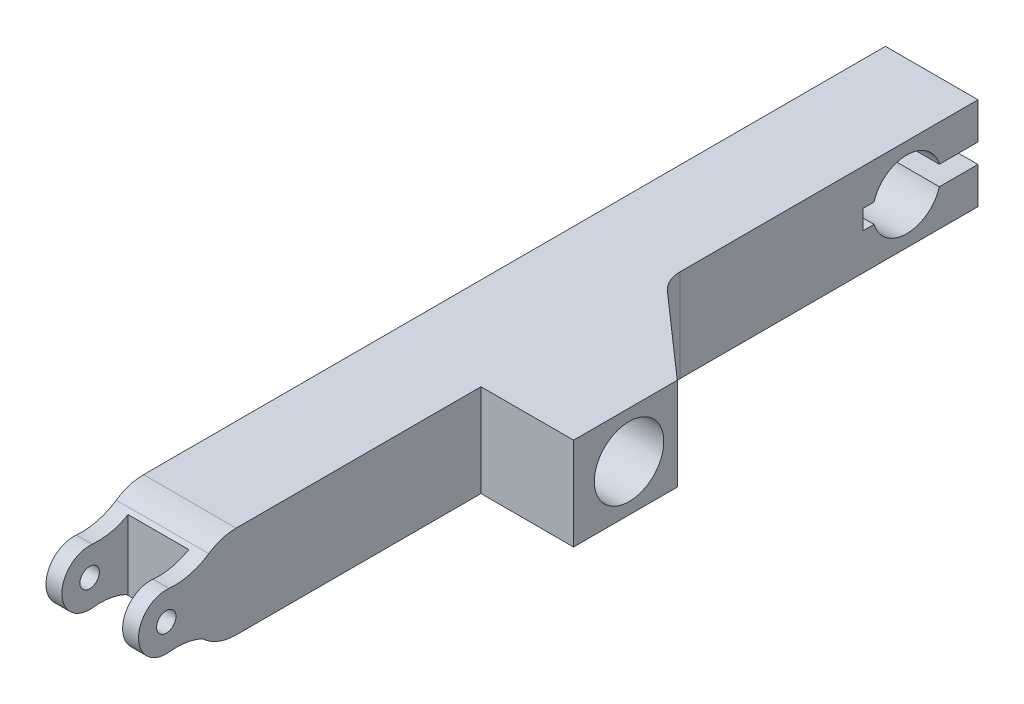
from build123d import *

# Parameters (mm, degrees)
SKETCH1_R           = 14.2875
BOSS_EXTRUDE1_DEPTH = 38.1
SKETCH2_W           = 76.2
SKETCH2_H           = 38.1
SKETCH2_R           = 14.2875
BOSS_EXTRUDE2_DEPTH = 38.1
CUT_EXTRUDE1_DEPTH  = 38.1
FILLET1_R           = 12.7
SKETCH4_W           = 38.1
SKETCH4_H           = 38.1
BOSS_EXTRUDE3_DEPTH = 152.4
SKETCH5_R           = 4
CUT_EXTRUDE2_DEPTH  = 152.4
SKETCH6_W           = 25
SKETCH6_H           = 54.519891076
CUT_EXTRUDE3_DEPTH  = 152.4


with BuildPart() as part:
    # Sketch1 → Boss-Extrude1 (new body)
    with BuildSketch(Plane(origin=(0, 0, 0), x_dir=(0, 0, -1), z_dir=(1, 0, 0))):
        with BuildLine():
            Line((29.337186502, -19.05), (-175.255687154, -19.05))
            Line((-175.255687154, -19.05), (-175.255687154, 19.05))
            Line((-175.255687154, 19.05), (29.337186502, 19.05))
            Line((29.337186502, 19.05), (29.337186502, 4))
            Line((29.337186502, 4), (13.442493258, 4))
            ThreePointArc((13.442493258, 4), (0, 14.025), (-13.442493258, 4))
            Line((-13.442493258, 4), (-18.025, 4))
            Line((-18.025, 4), (-18.025, -4))
            Line((-18.025, -4), (-13.442493258, -4))
            ThreePointArc((-13.442493258, -4), (0, -14.025), (13.442493258, -4))
            Line((13.442493258, -4), (29.337186502, -4))
            Line((29.337186502, -4), (29.337186502, -19.05))
        make_face()
        with Locations(Location((-152.4, 0, 0), (0, 0, 180))):
            Circle(SKETCH1_R, mode=Mode.SUBTRACT)
    extrude(amount=BOSS_EXTRUDE1_DEPTH)

    # Sketch2 → Boss-Extrude2 (add)
    with BuildSketch(Plane(origin=(38.1, 0, 0), x_dir=(0, 0, -1), z_dir=(1, 0, 0))):
        with Locations((-137.155687154, 0)):
            Rectangle(SKETCH2_W, SKETCH2_H)
        with Locations(Location((-152.4, 0, 0), (0, 0, 180))):
            Circle(SKETCH2_R, mode=Mode.SUBTRACT)
    extrude(amount=BOSS_EXTRUDE2_DEPTH)

    # Sketch3 → Cut-Extrude1 (cut)
    with BuildSketch(Plane(origin=(0, 19.05, 0), x_dir=(1, 0, 0), z_dir=(0, 1, 0))):
        Polygon((38.1, -99.055687154), (76.2, -132.562404594), (94.277321555, -84.449227978), align=None)
    extrude(amount=-CUT_EXTRUDE1_DEPTH, mode=Mode.SUBTRACT)

    # Fillet1
    fillet1_edges = [part.edges().sort_by_distance(p)[0] for p in [
        (38.1, 0, 99.055687154),
    ]]
    fillet(fillet1_edges, radius=FILLET1_R)

    # Sketch4 → Boss-Extrude3 (add)
    with BuildSketch(Plane.XY.offset(175.255687154)):
        with Locations((19.05, 0)):
            Rectangle(SKETCH4_W, SKETCH4_H)
    extrude(amount=BOSS_EXTRUDE3_DEPTH)

    # Sketch5 → Cut-Extrude2 (cut)
    with BuildSketch(Plane.ZY):
        Polygon((276.061983206, 26.741787919), (276.061983206, 19.05), (327.655687154, 19.05), (327.655687154, -19.05), (276.061983206, -19.05), (276.061983206, -31.426856949), (335.038222157, -31.426856949), (335.038222157, 26.741787919), align=None)
        with BuildLine():
            Line((327.655687154, 19.05), (276.061983206, 19.05))
            ThreePointArc((276.061983206, 19.05), (281.943389767, 18.165675684), (287.304689246, 15.590905686))
            ThreePointArc((287.304689246, 15.590905686), (295.144592117, 12.051491747), (303.720086759, 11.378870216))
            ThreePointArc((303.720086759, 11.378870216), (312.490952205, 8.455421585), (316.23, 0))
            ThreePointArc((316.23, 0), (312.381148337, -8.554010165), (303.426659685, -11.347195089))
            ThreePointArc((303.426659685, -11.347195089), (296.515249828, -11.473357637), (289.902590337, -13.487367982))
            ThreePointArc((289.902590337, -13.487367982), (283.520288655, -17.607307989), (276.061983206, -19.05))
            Line((276.061983206, -19.05), (327.655687154, -19.05))
            Line((327.655687154, -19.05), (327.655687154, 19.05))
        make_face()
        with Locations((304.8, 0)):
            Circle(SKETCH5_R)
    extrude(amount=-CUT_EXTRUDE2_DEPTH, mode=Mode.SUBTRACT)

    # Sketch6 → Cut-Extrude3 (cut)
    with BuildSketch(Plane.XZ.offset(19.05)):
        with Locations((19.05, 316.23)):
            Rectangle(SKETCH6_W, SKETCH6_H)
    extrude(amount=-CUT_EXTRUDE3_DEPTH, mode=Mode.SUBTRACT)


solid = part.part
